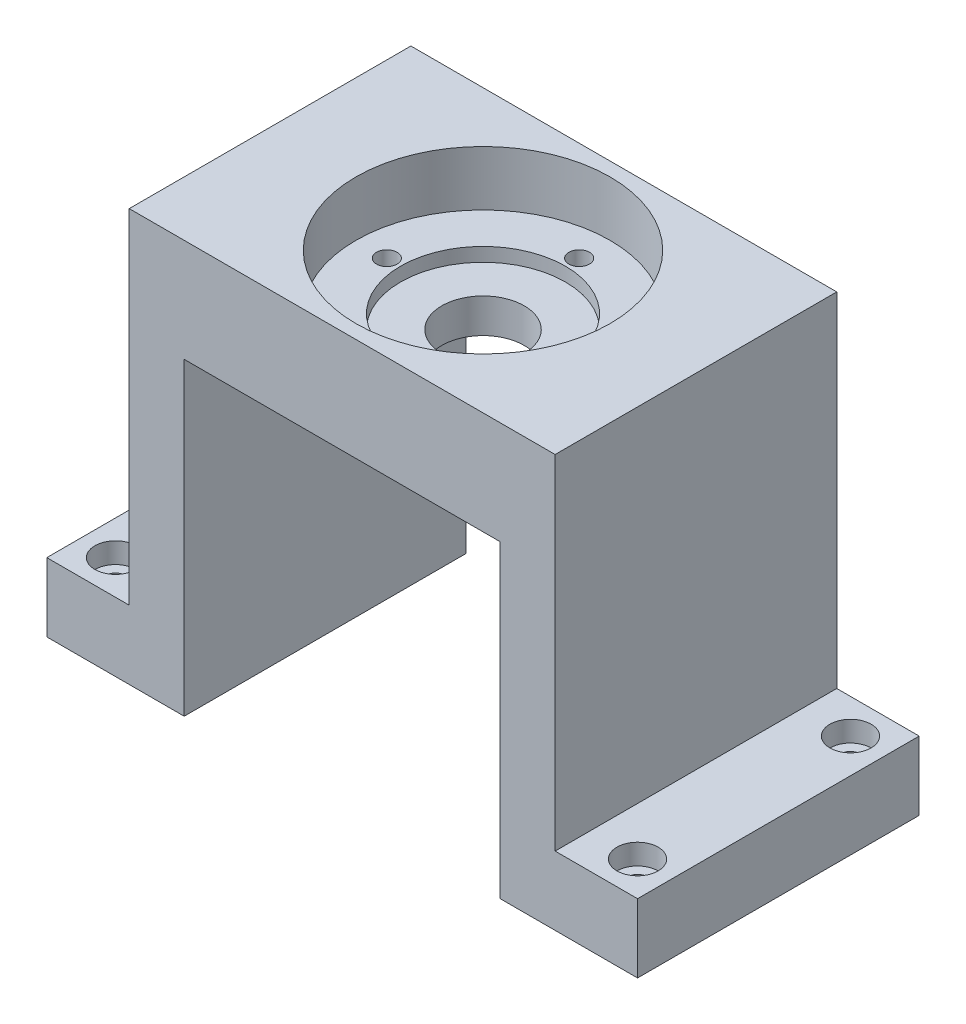
from build123d import *

# Parameters (mm, degrees)
SKETCH1_W                      = 20
SKETCH1_H                      = 41
BOSS_EXTRUDE1_DEPTH            = 10
BOSS_EXTRUDE1_2_DEPTH          = 10
SKETCH2_R                      = 1.5
CUT_EXTRUDE1_DEPTH             = 10
SKETCH3_R                      = 3
CUT_EXTRUDE2_DEPTH             = 3
SKETCH4_W                      = 8
SKETCH4_H                      = 41
BOSS_EXTRUDE2_DEPTH            = 35
SKETCH5_W                      = 62
SKETCH5_H                      = 41
BOSS_EXTRUDE3_DEPTH            = 15
CUT_EXTRUDE3_REACH             = 78.611
SKETCH6_R                      = 1.5
SKETCH7_R                      = 3
CUT_EXTRUDE4_DEPTH             = 3
SKETCH8_R                      = 12
CUT_EXTRUDE5_DEPTH             = 10
CUT_EXTRUDE6_REACH             = 78.611
SKETCH9_R                      = 6
CUT_EXTRUDE6_DIRECTION_2_DEPTH = 77.611030537
SKETCH10_R                     = 18.5
CUT_EXTRUDE7_DEPTH             = 8


with BuildPart() as part:
    # Sketch1 → Boss-Extrude1 (new body)
    with BuildSketch(Plane(origin=(0, 0, 0), x_dir=(1, 0, 0), z_dir=(0, 1, 0))):
        with Locations((33, 0)):
            Rectangle(SKETCH1_W, SKETCH1_H)
    extrude(amount=BOSS_EXTRUDE1_DEPTH)


with BuildPart() as body_2:
    # Sketch1 → Boss-Extrude1 2 (new body)
    with BuildSketch(Plane(origin=(0, 0, 0), x_dir=(1, 0, 0), z_dir=(0, 1, 0))):
        with Locations((-33, 0)):
            Rectangle(SKETCH1_W, SKETCH1_H)
    extrude(amount=BOSS_EXTRUDE1_2_DEPTH)


with BuildPart() as cut_extrude1_tool:
    # Sketch2 → Cut-Extrude1 (new body)
    with BuildSketch(Plane(origin=(0, 10, 0), x_dir=(1, 0, 0), z_dir=(0, 1, 0))):
        with Locations(Location((-38, 15.5, 0), (0, 0, 270))):
            Circle(SKETCH2_R)
        with Locations(Location((-38, -15.5, 0), (0, 0, 270))):
            Circle(SKETCH2_R)
        with Locations(Location((38, -15.5, 0), (0, 0, 270))):
            Circle(SKETCH2_R)
        with Locations(Location((38, 15.5, 0), (0, 0, 270))):
            Circle(SKETCH2_R)
    extrude(amount=-CUT_EXTRUDE1_DEPTH)


with BuildPart() as part_1:
    add(part.part)

    # Cut-Extrude1: cut by cut_extrude1_tool
    add(cut_extrude1_tool.part, mode=Mode.SUBTRACT)


with BuildPart() as body_2_1:
    add(body_2.part)

    # Cut-Extrude1: cut by cut_extrude1_tool
    add(cut_extrude1_tool.part, mode=Mode.SUBTRACT)


with BuildPart() as cut_extrude2_tool:
    # Sketch3 → Cut-Extrude2 (new body)
    with BuildSketch(Plane(origin=(0, 10, 0), x_dir=(1, 0, 0), z_dir=(0, 1, 0))):
        with Locations(Location((-38, 15.5, 0), (0, 0, 270))):
            Circle(SKETCH3_R)
        with Locations(Location((-38, -15.5, 0), (0, 0, 270))):
            Circle(SKETCH3_R)
        with Locations(Location((38, -15.5, 0), (0, 0, 270))):
            Circle(SKETCH3_R)
        with Locations(Location((38, 15.5, 0), (0, 0, 270))):
            Circle(SKETCH3_R)
    extrude(amount=-CUT_EXTRUDE2_DEPTH)


with BuildPart() as part_2:
    add(part_1.part)

    # Cut-Extrude2: cut by cut_extrude2_tool
    add(cut_extrude2_tool.part, mode=Mode.SUBTRACT)



with BuildPart() as body_2_2:
    add(body_2_1.part)

    # Cut-Extrude2: cut by cut_extrude2_tool
    add(cut_extrude2_tool.part, mode=Mode.SUBTRACT)


with BuildPart() as part_3:
    add(part_2.part)

    add(body_2_2.part)  # Boss-Extrude2 merges body 2
    # Sketch4 → Boss-Extrude2 (add)
    with BuildSketch(Plane(origin=(0, 10, 0), x_dir=(1, 0, 0), z_dir=(0, 1, 0))):
        with Locations((-27, 0)):
            Rectangle(SKETCH4_W, SKETCH4_H)
        with Locations((27, 0)):
            Rectangle(SKETCH4_W, SKETCH4_H)
    extrude(amount=BOSS_EXTRUDE2_DEPTH)

    # Sketch5 → Boss-Extrude3 (add)
    with BuildSketch(Plane(origin=(0, 45, 0), x_dir=(1, 0, 0), z_dir=(0, 1, 0))):
        Rectangle(SKETCH5_W, SKETCH5_H)
    extrude(amount=BOSS_EXTRUDE3_DEPTH)

    # Sketch6 → Cut-Extrude3 (cut, up to next)
    with BuildSketch(Plane(origin=(0, 60, 0), x_dir=(1, 0, 0), z_dir=(0, 1, 0)), mode=Mode.PRIVATE) as cut_extrude3_sk1:
        with Locations(Location((-14, 0, 0), (0, 0, 270))):
            Circle(SKETCH6_R)
    cut_extrude3_tool1 = extrude(cut_extrude3_sk1.sketch, amount=-CUT_EXTRUDE3_REACH, mode=Mode.PRIVATE) & part_3.part
    # Sketch6 → Cut-Extrude3 (cut, up to next)
    with BuildSketch(Plane(origin=(0, 60, 0), x_dir=(1, 0, 0), z_dir=(0, 1, 0)), mode=Mode.PRIVATE) as cut_extrude3_sk2:
        with Locations(Location((0, 14, 0), (0, 0, 270))):
            Circle(SKETCH6_R)
    cut_extrude3_tool2 = extrude(cut_extrude3_sk2.sketch, amount=-CUT_EXTRUDE3_REACH, mode=Mode.PRIVATE) & part_3.part
    # Sketch6 → Cut-Extrude3 (cut, up to next)
    with BuildSketch(Plane(origin=(0, 60, 0), x_dir=(1, 0, 0), z_dir=(0, 1, 0)), mode=Mode.PRIVATE) as cut_extrude3_sk3:
        with Locations(Location((14, 0, 0), (0, 0, 270))):
            Circle(SKETCH6_R)
    cut_extrude3_tool3 = extrude(cut_extrude3_sk3.sketch, amount=-CUT_EXTRUDE3_REACH, mode=Mode.PRIVATE) & part_3.part
    # Sketch6 → Cut-Extrude3 (cut, up to next)
    with BuildSketch(Plane(origin=(0, 60, 0), x_dir=(1, 0, 0), z_dir=(0, 1, 0)), mode=Mode.PRIVATE) as cut_extrude3_sk4:
        with Locations(Location((0, -14, 0), (0, 0, 270))):
            Circle(SKETCH6_R)
    cut_extrude3_tool4 = extrude(cut_extrude3_sk4.sketch, amount=-CUT_EXTRUDE3_REACH, mode=Mode.PRIVATE) & part_3.part
    add(cut_extrude3_tool1.solids().sort_by_distance((-14, 60, 0))[0], mode=Mode.SUBTRACT)
    add(cut_extrude3_tool2.solids().sort_by_distance((0, 60, -14))[0], mode=Mode.SUBTRACT)
    add(cut_extrude3_tool3.solids().sort_by_distance((14, 60, 0))[0], mode=Mode.SUBTRACT)
    add(cut_extrude3_tool4.solids().sort_by_distance((0, 60, 14))[0], mode=Mode.SUBTRACT)

    # Sketch7 → Cut-Extrude4 (cut)
    with BuildSketch(Plane.XZ.offset(-45)):
        with Locations(Location((0, 14, 0), (0, 0, 270))):
            Circle(SKETCH7_R)
        with Locations(Location((14, 0, 0), (0, 0, 270))):
            Circle(SKETCH7_R)
        with Locations(Location((0, -14, 0), (0, 0, 270))):
            Circle(SKETCH7_R)
        with Locations(Location((-14, 0, 0), (0, 0, 270))):
            Circle(SKETCH7_R)
    extrude(amount=-CUT_EXTRUDE4_DEPTH, mode=Mode.SUBTRACT)

    # Sketch8 → Cut-Extrude5 (cut)
    with BuildSketch(Plane(origin=(0, 60, 0), x_dir=(1, 0, 0), z_dir=(0, 1, 0))):
        with Locations(Location((0, 0, 0), (0, 0, 270))):
            Circle(SKETCH8_R)
    extrude(amount=-CUT_EXTRUDE5_DEPTH, mode=Mode.SUBTRACT)

    # Sketch9 → Cut-Extrude6 (cut, up to next)
    with BuildSketch(Plane(origin=(0, 60, 0), x_dir=(1, 0, 0), z_dir=(0, 1, 0)), mode=Mode.PRIVATE) as cut_extrude6_sk1:
        with Locations(Location((0, 0, 0), (0, 0, 270))):
            Circle(SKETCH9_R)
    cut_extrude6_tool1 = extrude(cut_extrude6_sk1.sketch, amount=-CUT_EXTRUDE6_REACH, mode=Mode.PRIVATE) & part_3.part
    add(cut_extrude6_tool1.solids().sort_by_distance((0, 60, 0))[0], mode=Mode.SUBTRACT)

    # Sketch9 → Cut-Extrude6 direction 2 (cut)
    with BuildSketch(Plane(origin=(0, 60, 0), x_dir=(1, 0, 0), z_dir=(0, 1, 0))):
        with Locations(Location((0, 0, 0), (0, 0, 270))):
            Circle(SKETCH9_R)
    extrude(amount=CUT_EXTRUDE6_DIRECTION_2_DEPTH, mode=Mode.SUBTRACT)

    # Sketch10 → Cut-Extrude7 (cut)
    with BuildSketch(Plane(origin=(0, 60, 0), x_dir=(1, 0, 0), z_dir=(0, 1, 0))):
        with Locations(Location((0, 0, 0), (0, 0, 270))):
            Circle(SKETCH10_R)
    extrude(amount=-CUT_EXTRUDE7_DEPTH, mode=Mode.SUBTRACT)


solid = part_3.part
